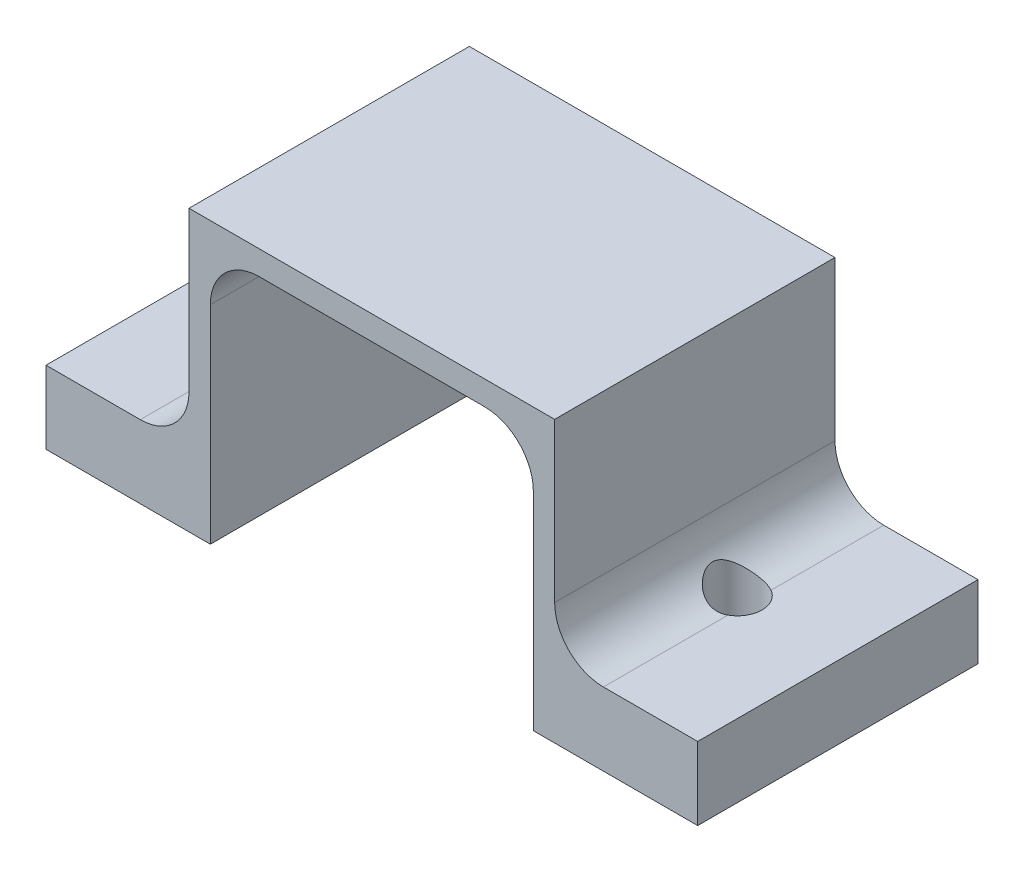
from build123d import *

# Parameters (mm, degrees)
BOSS_EXTRUDE1_DEPTH     = 11.5
CUT_EXTRUDE2_DEPTH      = 20.579495528
CUT_EXTRUDE2_DEPTH_BACK = 20.579495528
SKETCH2_R               = 1.016


with BuildPart() as part:
    # Sketch1 → Boss-Extrude1 (new body)
    with BuildSketch(Plane.XY):
        with BuildLine():
            Line((7.5, 9.576744186), (0, 9.576744186))
            Line((0, 9.576744186), (0, 8.586804732))
            Line((0, 8.586804732), (4.625286285, 8.586804732))
            ThreePointArc((4.625286285, 8.586804732), (6.039499847, 8.001018294), (6.625286285, 6.586804732))
            Line((6.625286285, 6.586804732), (6.625286285, -1.923255814))
            Line((6.625286285, -1.923255814), (13.367366986, -1.923255814))
            Line((13.367366986, -1.923255814), (13.367366986, 1.066741541))
            Line((13.367366986, 1.066741541), (9.5, 1.066741541))
            ThreePointArc((9.5, 1.066741541), (8.085786438, 1.652527979), (7.5, 3.066741541))
            Line((7.5, 3.066741541), (7.5, 9.576744186))
        make_face()
        with BuildLine():
            Line((0, 9.576744186), (-7.5, 9.576744186))
            Line((-7.5, 9.576744186), (-7.5, 3.066741541))
            ThreePointArc((-7.5, 3.066741541), (-8.085786438, 1.652527979), (-9.5, 1.066741541))
            Line((-9.5, 1.066741541), (-13.367366986, 1.066741541))
            Line((-13.367366986, 1.066741541), (-13.367366986, -1.923255814))
            Line((-13.367366986, -1.923255814), (-6.625286285, -1.923255814))
            Line((-6.625286285, -1.923255814), (-6.625286285, 6.586804732))
            ThreePointArc((-6.625286285, 6.586804732), (-6.039499847, 8.001018294), (-4.625286285, 8.586804732))
            Line((-4.625286285, 8.586804732), (0, 8.586804732))
            Line((0, 8.586804732), (0, 9.576744186))
        make_face()
    extrude(amount=BOSS_EXTRUDE1_DEPTH)

    # Sketch2 → Cut-Extrude2 (cut, two sides: drawn at the far end of the back side and taken through both)
    with BuildSketch(Plane(origin=(0, 1.066741541, 0), x_dir=(1, 0, 0), z_dir=(0, 1, 0)).offset(-CUT_EXTRUDE2_DEPTH_BACK)):
        with Locations(Location((-9, -5.507720323, 0), (0, 0, 180))):
            Circle(SKETCH2_R)
        with Locations(Location((9, -5.507720323, 0), (0, 0, 180))):
            Circle(SKETCH2_R)
    extrude(amount=CUT_EXTRUDE2_DEPTH + CUT_EXTRUDE2_DEPTH_BACK, mode=Mode.SUBTRACT)


solid = part.part
